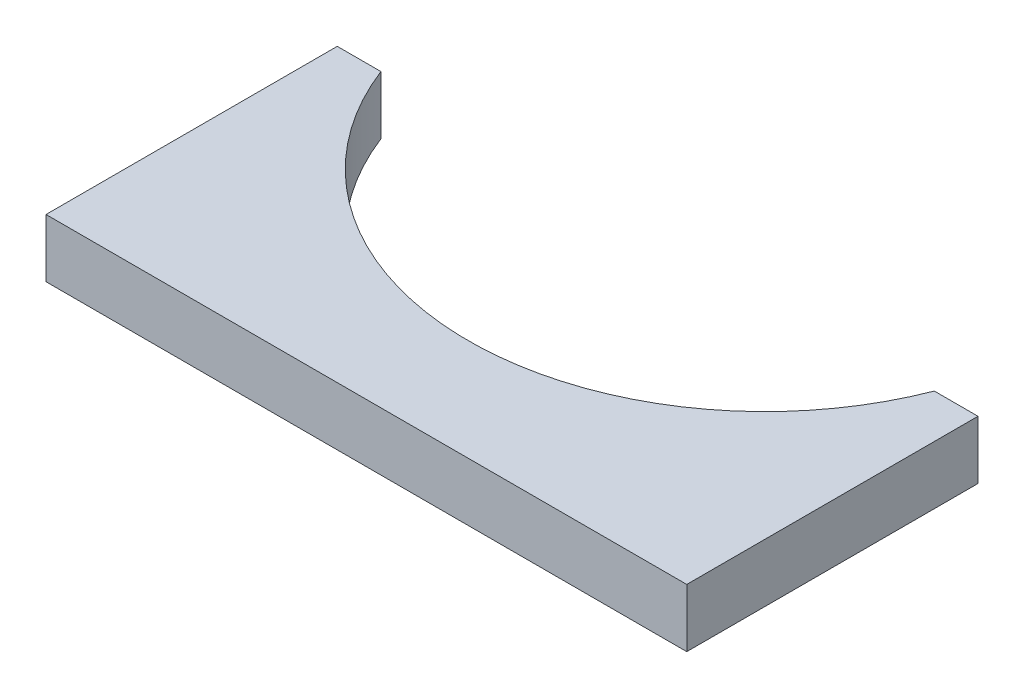
from build123d import *

# Parameters (mm, degrees)
BOSS_EXTRUDE1_DEPTH = 2.54


with BuildPart() as part:
    # Sketch1 → Boss-Extrude1 (new body)
    with BuildSketch(Plane(origin=(0, 0, 0), x_dir=(1, 0, 0), z_dir=(0, 1, 0))):
        with BuildLine():
            Line((13.97, 0), (-13.97, 0))
            Line((-13.97, 0), (-13.97, 12.7))
            Line((-13.97, 12.7), (-12.065, 12.7))
            ThreePointArc((-12.065, 12.7), (0, 4.44037227), (12.065, 12.7))
            Line((12.065, 12.7), (13.97, 12.7))
            Line((13.97, 12.7), (13.97, 0))
        make_face()
    extrude(amount=BOSS_EXTRUDE1_DEPTH)


solid = part.part
